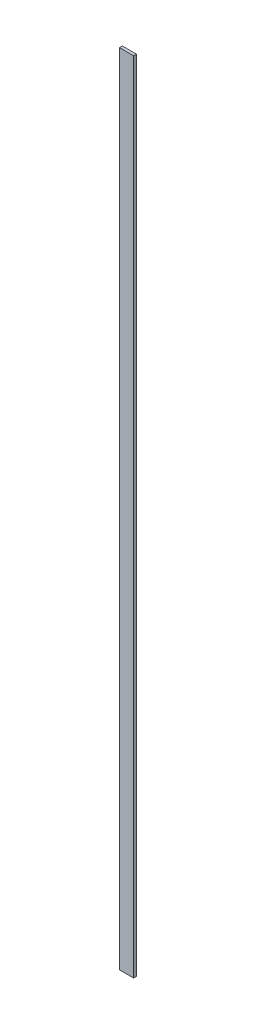
from build123d import *

# Parameters (mm, degrees)
SKETCH1_W           = 40
SKETCH1_H           = 8
BOSS_EXTRUDE1_DEPTH = 1140


with BuildPart() as part:
    # Sketch1 → Boss-Extrude1 (new, symmetric)
    with BuildSketch(Plane(origin=(0, 0, 0), x_dir=(1, 0, 0), z_dir=(0, 1, 0))):
        Rectangle(SKETCH1_W, SKETCH1_H)
    extrude(amount=BOSS_EXTRUDE1_DEPTH, both=True)


solid = part.part
